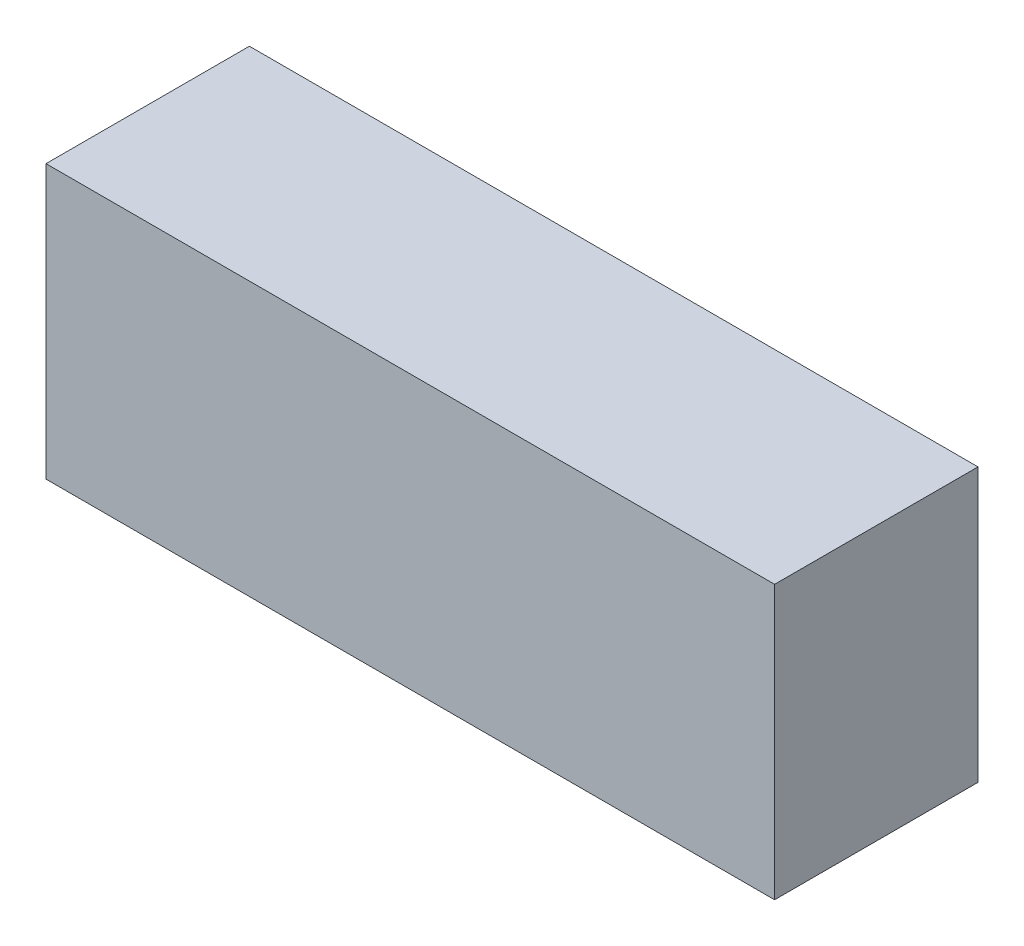
from build123d import *

# Parameters (mm, degrees)
ESBO_O1_W                = 120
ESBO_O1_H                = 45
RESSALTO_EXTRUS_O1_DEPTH = 33.5


with BuildPart() as part:
    # Esboço1 → Ressalto-extrusão1 (new body)
    with BuildSketch(Plane.XY):
        Rectangle(ESBO_O1_W, ESBO_O1_H)
    extrude(amount=-RESSALTO_EXTRUS_O1_DEPTH)


solid = part.part
